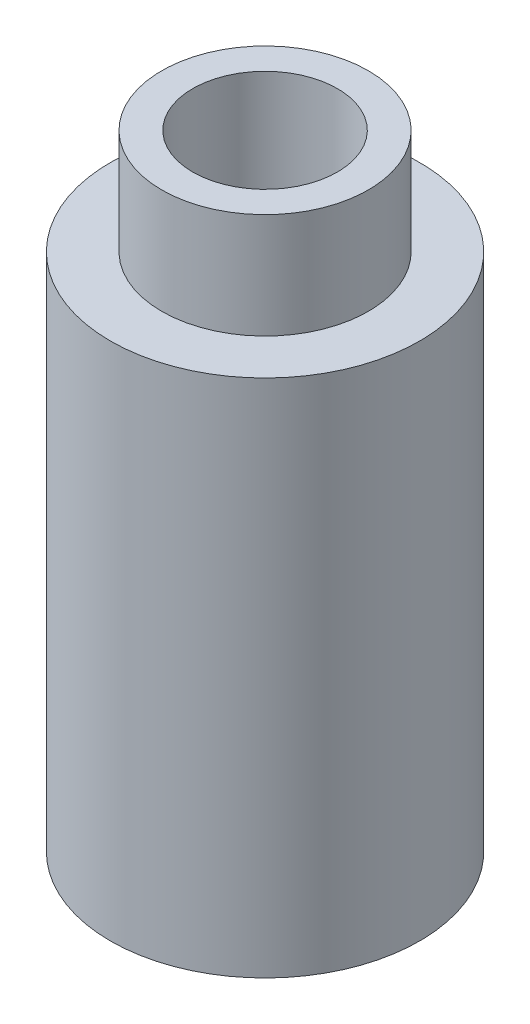
from build123d import *

# Parameters (mm, degrees)
SKETCH1_R           = 9.4488
BOSS_EXTRUDE1_DEPTH = 31.75
SKETCH2_R           = 6.3119
BOSS_EXTRUDE2_DEPTH = 6.4262
SKETCH3_R           = 4.4196
CUT_EXTRUDE1_DEPTH  = 41.447272953


with BuildPart() as part:
    # Sketch1 → Boss-Extrude1 (new body)
    with BuildSketch(Plane(origin=(0, 0, 0), x_dir=(1, 0, 0), z_dir=(0, 1, 0))):
        with Locations(Location((0, 0, 0), (0, 0, 270))):
            Circle(SKETCH1_R)
    extrude(amount=BOSS_EXTRUDE1_DEPTH)

    # Sketch2 → Boss-Extrude2 (add)
    with BuildSketch(Plane(origin=(0, 31.75, 0), x_dir=(1, 0, 0), z_dir=(0, 1, 0))):
        with Locations(Location((0, 0, 0), (0, 0, 270))):
            Circle(SKETCH2_R)
    extrude(amount=BOSS_EXTRUDE2_DEPTH)

    # Sketch3 → Cut-Extrude1 (cut, through all)
    with BuildSketch(Plane(origin=(0, 38.1762, 0), x_dir=(1, 0, 0), z_dir=(0, 1, 0))):
        with Locations(Location((0, 0, 0), (0, 0, 270))):
            Circle(SKETCH3_R)
    extrude(amount=-CUT_EXTRUDE1_DEPTH, mode=Mode.SUBTRACT)


solid = part.part
